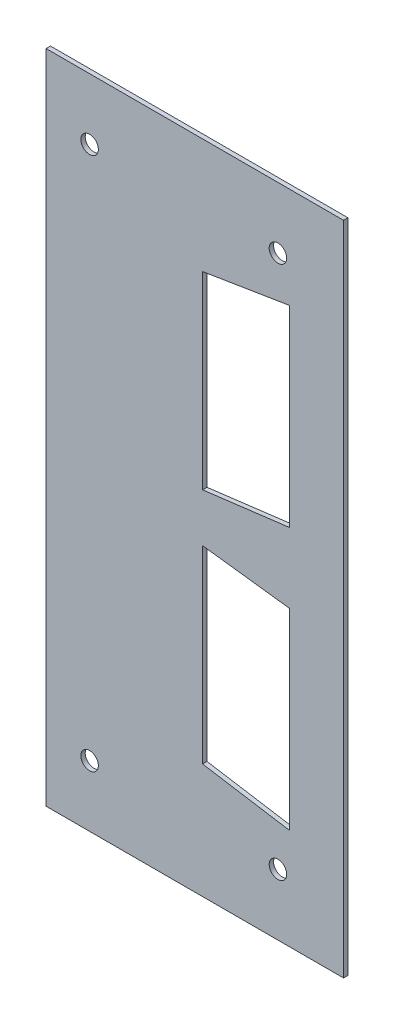
from build123d import *

# Parameters (mm, degrees)
SKETCH1_W           = 68
SKETCH1_H           = 150
BOSS_EXTRUDE1_DEPTH = 1
SKETCH2_R           = 2
CUT_EXTRUDE1_DEPTH  = 1
CUT_EXTRUDE2_DEPTH  = 20


with BuildPart() as part:
    # Sketch1 → Boss-Extrude1 (new body)
    with BuildSketch(Plane.XY):
        with Locations((34, 75)):
            Rectangle(SKETCH1_W, SKETCH1_H)
    extrude(amount=BOSS_EXTRUDE1_DEPTH)

    # Sketch2 → Cut-Extrude1 (cut)
    with BuildSketch(Plane.XY.offset(1)):
        with Locations((9.95, 14)):
            Circle(SKETCH2_R)
        with Locations((53, 14)):
            Circle(SKETCH2_R)
        with Locations(Location((53, 136, 0), (0, 0, 180))):
            Circle(SKETCH2_R)
        with Locations(Location((9.95, 136, 0), (0, 0, 180))):
            Circle(SKETCH2_R)
    extrude(amount=-CUT_EXTRUDE1_DEPTH, mode=Mode.SUBTRACT)

    # Sketch3 → Cut-Extrude2 (cut)
    with BuildSketch(Plane(origin=(0, 0, 0), x_dir=(-1, 0, 0), z_dir=(0, 0, -1))):
        Polygon((-35.78, 80.53), (-35.78, 123.74), (-55.64, 126.96), (-55.64, 83.01), align=None)
        Polygon((-55.64, 66.99), (-35.78, 69.47), (-35.78, 26.26), (-55.64, 23.04), align=None)
    extrude(amount=-CUT_EXTRUDE2_DEPTH, mode=Mode.SUBTRACT)


solid = part.part
